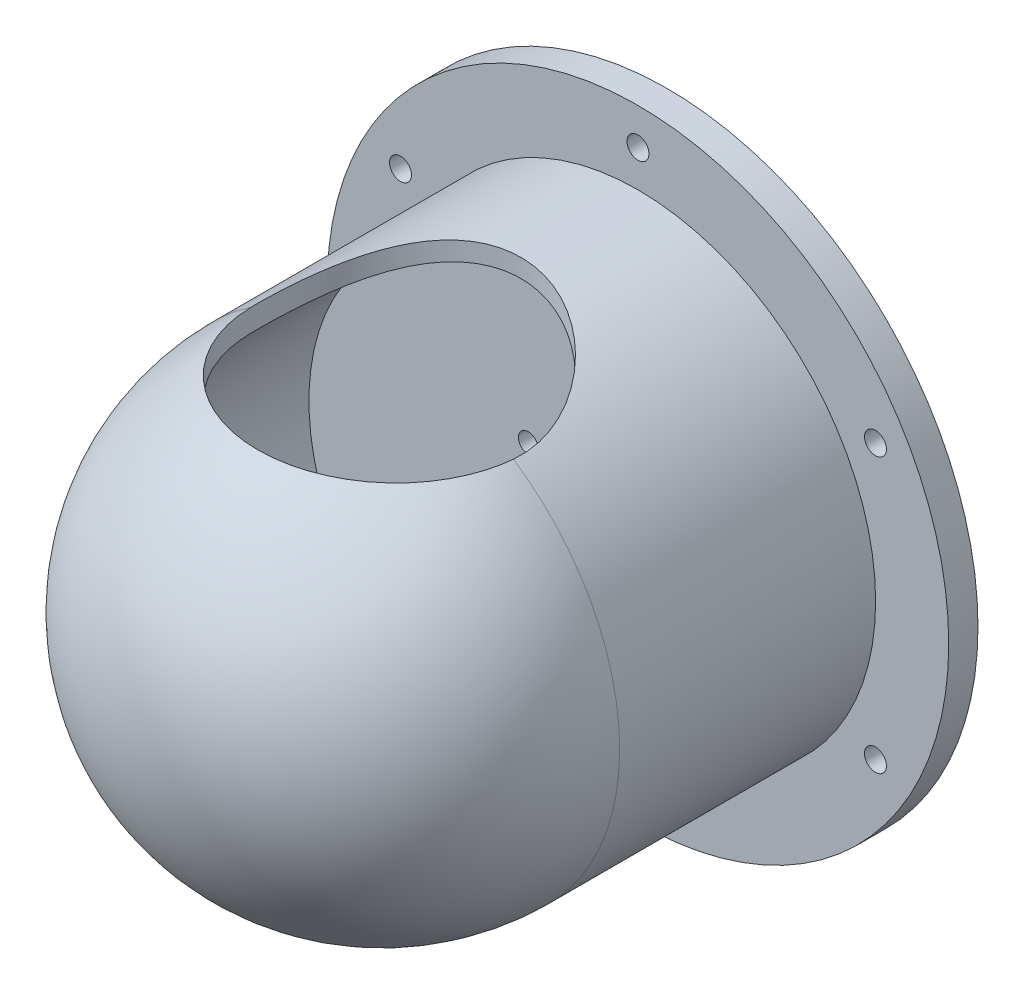
from build123d import *

# Parameters (mm, degrees)
SKETCH_5_R          = 36
CUT_EXTRUDE_1_DEPTH = 191
SKETCH_6_R          = 3
CUT_EXTRUDE_3_DEPTH = 225
SKETCH_7_R          = 2.7
CUT_EXTRUDE_4_DEPTH = 111


with BuildPart() as part:
    # 草图1 → 旋转6 (revolve)
    with BuildSketch(Plane(origin=(0, 0, 0), x_dir=(0, 0, -1), z_dir=(1, 0, 0)), mode=Mode.PRIVATE) as revolve_6_sk:
        with BuildLine():
            Line((3.317174788, 159.625816033), (43.317174788, 159.625816033))
            Line((43.317174788, 159.625816033), (73.317174788, 159.625816033))
            Line((73.317174788, 159.625816033), (73.317174788, 179.625816033))
            Line((73.317174788, 179.625816033), (81.317174788, 179.625816033))
            Line((81.317174788, 179.625816033), (81.317174788, 154.625816033))
            Line((81.317174788, 154.625816033), (73.317174788, 154.625816033))
            Line((73.317174788, 154.625816033), (53.317174788, 154.625816033))
            Line((53.317174788, 154.625816033), (53.317174788, 94.625816033))
            Line((53.317174788, 94.625816033), (43.317174788, 94.625816033))
            Line((43.317174788, 94.625816033), (43.317174788, 154.625816033))
            Line((43.317174788, 154.625816033), (3.317174788, 154.625816033))
            ThreePointArc((3.317174788, 154.625816033), (-39.109232083, 137.052222904), (-56.682825212, 94.625816033))
            Line((-56.682825212, 94.625816033), (-61.682825212, 94.625816033))
            ThreePointArc((-61.682825212, 94.625816033), (-42.644765989, 140.58775681), (3.317174788, 159.625816033))
        make_face()
    revolve(revolve_6_sk.sketch.rotate(Axis((0, 94.625816033, -43.317174788), (0, 0, -1)), 90), axis=Axis((0, 94.625816033, -43.317174788), (0, 0, -1)))

    # 草图5 → 切除-拉伸1 (cut)
    with BuildSketch(Plane(origin=(0, 0, 0), x_dir=(1, 0, 0), z_dir=(0, 1, 0))):
        with Locations(Location((0, 5.317174788, 0), (0, 0, 183.184738537))):
            Circle(SKETCH_5_R)
    extrude(amount=CUT_EXTRUDE_1_DEPTH, mode=Mode.SUBTRACT)

    # 草图6 → 切除-拉伸3 (cut)
    with BuildSketch(Plane.XY):
        with Locations((0, 169.625816033)):
            Circle(SKETCH_6_R)
        with Locations((0, 19.625816033)):
            Circle(SKETCH_6_R)
        with Locations((64.951905284, 132.125816033)):
            Circle(SKETCH_6_R)
        with Locations((64.951905284, 57.125816033)):
            Circle(SKETCH_6_R)
        with Locations((-64.951905284, 132.125816033)):
            Circle(SKETCH_6_R)
        with Locations((-64.951905284, 57.125816033)):
            Circle(SKETCH_6_R)
    extrude(amount=-CUT_EXTRUDE_3_DEPTH, mode=Mode.SUBTRACT)

    # 草图7 → 切除-拉伸4 (cut)
    with BuildSketch(Plane.XY):
        with Locations((0, 94.386174491)):
            Circle(SKETCH_7_R)
        with Locations((0, 114.625816033)):
            Circle(SKETCH_7_R)
        with Locations((0, 74.386174491)):
            Circle(SKETCH_7_R)
    extrude(amount=-CUT_EXTRUDE_4_DEPTH, mode=Mode.SUBTRACT)


solid = part.part
